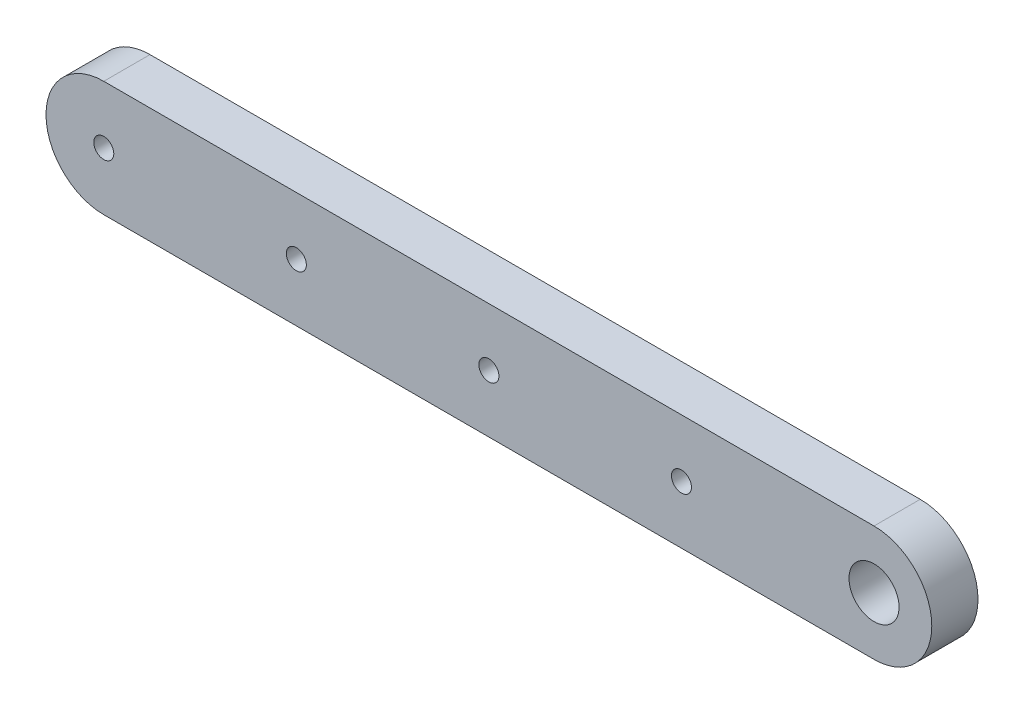
from build123d import *

# Parameters (mm, degrees)
SKETCH1_R           = 7.5
BOSS_EXTRUDE1_DEPTH = 6
SKETCH2_R           = 1.3
CUT_EXTRUDE1_DEPTH  = 108.928216885
LPATTERN1_COUNT     = 4
LPATTERN1_PITCH     = 25
SKETCH3_R           = 3.25
CUT_EXTRUDE2_DEPTH  = 108.928216885


with BuildPart() as part:
    # Sketch1 → Boss-Extrude1 (new body)
    with BuildSketch(Plane.XY):
        with BuildLine():
            Line((100, 7.5), (0, 7.5))
            ThreePointArc((0, 7.5), (5.303300859, 5.303300859), (7.5, 0))
            ThreePointArc((7.5, 0), (5.303300859, -5.303300859), (0, -7.5))
            Line((0, -7.5), (100, -7.5))
            ThreePointArc((100, -7.5), (92.5, 0), (100, 7.5))
        make_face()
        with Locations((100, 0)):
            Circle(SKETCH1_R)
        Circle(SKETCH1_R)
    extrude(amount=BOSS_EXTRUDE1_DEPTH)

    # Sketch2 → Cut-Extrude1 (cut, through all)
    with BuildSketch(Plane.XY.offset(6)):
        Circle(SKETCH2_R)
        with Locations((100, 0)):
            Circle(SKETCH2_R)
    cut_extrude1 = extrude(amount=-CUT_EXTRUDE1_DEPTH, mode=Mode.SUBTRACT)

    # LPattern1: Cut-Extrude1 ×4
    with Locations(*[(i * LPATTERN1_PITCH, 0, 0) for i in range(1, LPATTERN1_COUNT)]):
        add(cut_extrude1, mode=Mode.SUBTRACT)

    # Sketch3 → Cut-Extrude2 (cut, through all)
    with BuildSketch(Plane.XY.offset(6)):
        with Locations((100, 0)):
            Circle(SKETCH3_R)
    extrude(amount=-CUT_EXTRUDE2_DEPTH, mode=Mode.SUBTRACT)


solid = part.part
